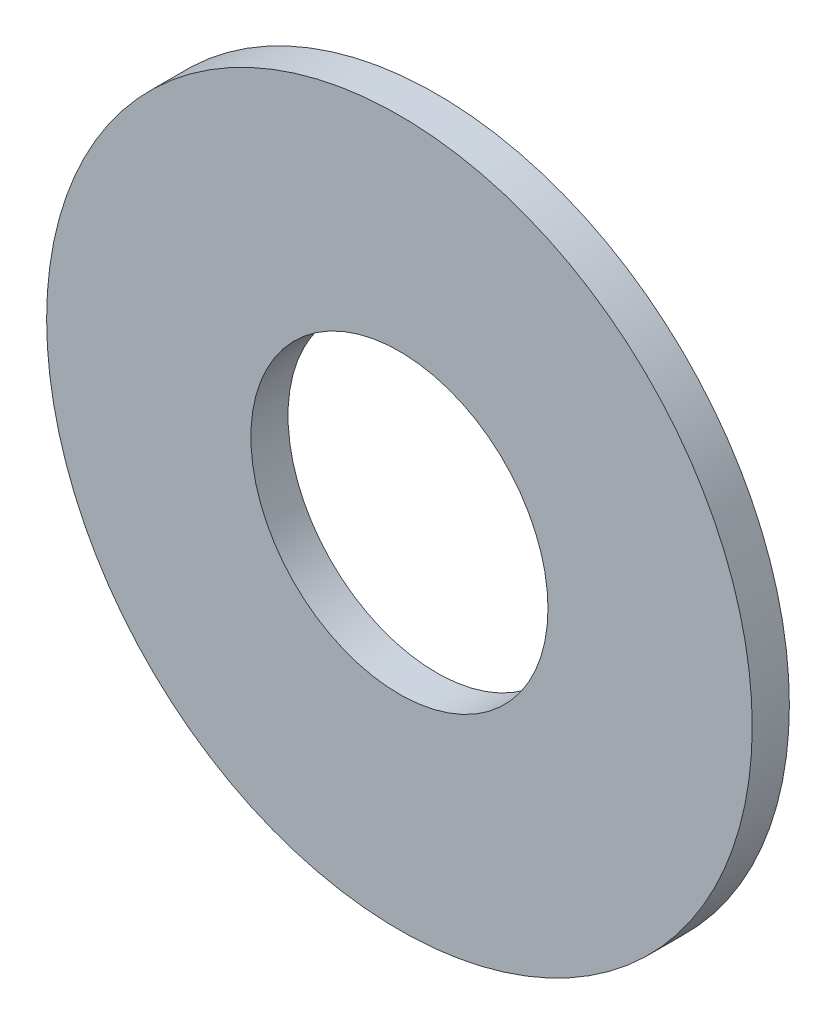
from build123d import *

# Parameters (mm, degrees)
SKETCH_1_R      = 9.5
SKETCH_1_R_2    = 4
EXTRUDE_1_DEPTH = 1


with BuildPart() as part:
    # 草图1 → 凸台-拉伸1 (new body)
    with BuildSketch(Plane.XY):
        Circle(SKETCH_1_R)
        Circle(SKETCH_1_R_2, mode=Mode.SUBTRACT)
    extrude(amount=EXTRUDE_1_DEPTH)


solid = part.part
